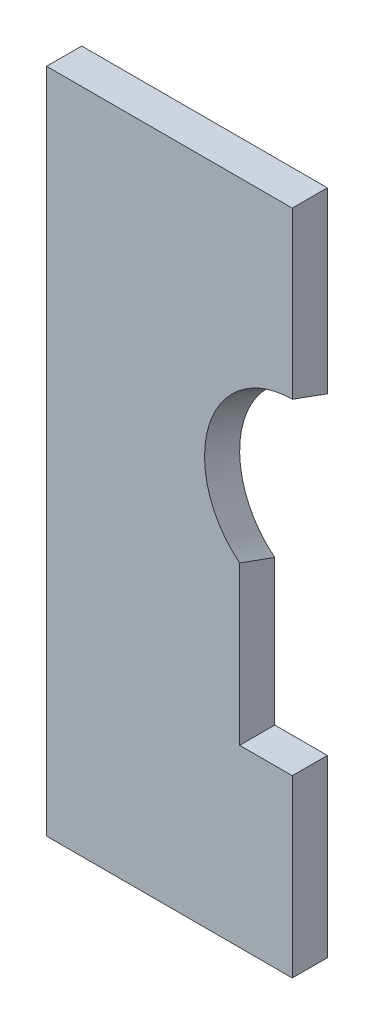
from build123d import *

# Parameters (mm, degrees)
ESQUISSE1_W             = 70
ESQUISSE1_H             = 190
BOSS_EXTRU_1_DEPTH      = 10
ENL_V_MAT_EXTRU_1_DEPTH = 203.731349327
ESQUISSE3_W             = 15
ESQUISSE3_H             = 45
ENL_V_MAT_EXTRU_2_DEPTH = 203.731349327


with BuildPart() as part:
    # Esquisse1 → Boss.-Extru.1 (new body)
    with BuildSketch(Plane.XY):
        with Locations((35, 95)):
            Rectangle(ESQUISSE1_W, ESQUISSE1_H)
    extrude(amount=BOSS_EXTRU_1_DEPTH)

    # Esquisse2 → Enlèv. mat.-Extru.1 (cut, through all)
    with BuildSketch(Plane(origin=(0, 0, 0), x_dir=(1, 0, 0), z_dir=(0, -0.34202014332566943, -0.9396926207859081))):
        with BuildLine():
            Line((70, -80.778483455), (70, -130.778483455))
            ThreePointArc((70, -130.778483455), (45, -105.778483455), (70, -80.778483455))
        make_face()
    extrude(amount=-ENL_V_MAT_EXTRU_1_DEPTH, mode=Mode.SUBTRACT)

    # Esquisse3 → Enlèv. mat.-Extru.2 (cut, through all)
    with BuildSketch(Plane(origin=(0, 0, 0), x_dir=(-1, 0, 0), z_dir=(0, 0, -1))):
        with Locations((-62.5, 72.423257792)):
            Rectangle(ESQUISSE3_W, ESQUISSE3_H)
    extrude(amount=-ENL_V_MAT_EXTRU_2_DEPTH, mode=Mode.SUBTRACT)


solid = part.part
